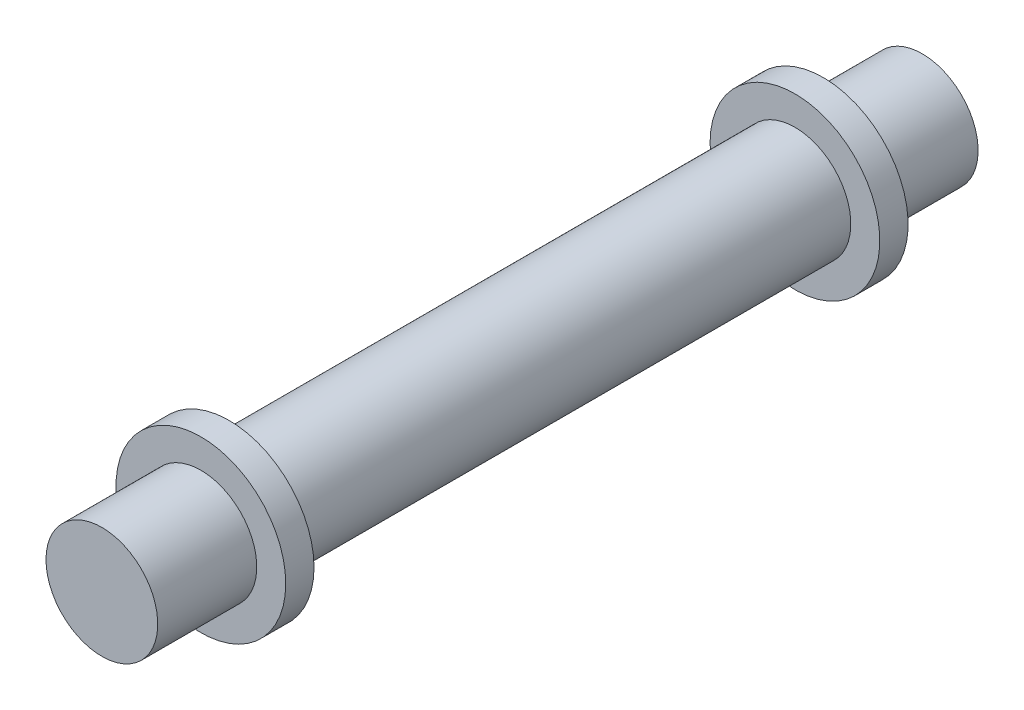
from build123d import *

# Parameters (mm, degrees)
SKETCH1_R           = 3.95
BOSS_EXTRUDE1_DEPTH = 58
SKETCH2_R           = 6
BOSS_EXTRUDE2_DEPTH = 2
BOSS_EXTRUDE3_START = -2
SKETCH3_R           = 6
BOSS_EXTRUDE3_DEPTH = 2


with BuildPart() as part:
    # Sketch1 → Boss-Extrude1 (new body)
    with BuildSketch(Plane.XY):
        with Locations(Location((0, 0, 0), (0, 0, 180))):
            Circle(SKETCH1_R)
    extrude(amount=BOSS_EXTRUDE1_DEPTH)

    # Sketch2 → Boss-Extrude2 (add)
    with BuildSketch(Plane.XY.offset(51)):
        Circle(SKETCH2_R)
    extrude(amount=-BOSS_EXTRUDE2_DEPTH)

    # Sketch3 → Boss-Extrude3 (add)
    with BuildSketch(Plane(origin=(0, 0, 7), x_dir=(-1, 0, 0), z_dir=(0, 0, -1)).offset(BOSS_EXTRUDE3_START)):
        with Locations(Location((0, 0, 0), (0, 0, 180))):
            Circle(SKETCH3_R)
    extrude(amount=BOSS_EXTRUDE3_DEPTH)


solid = part.part
